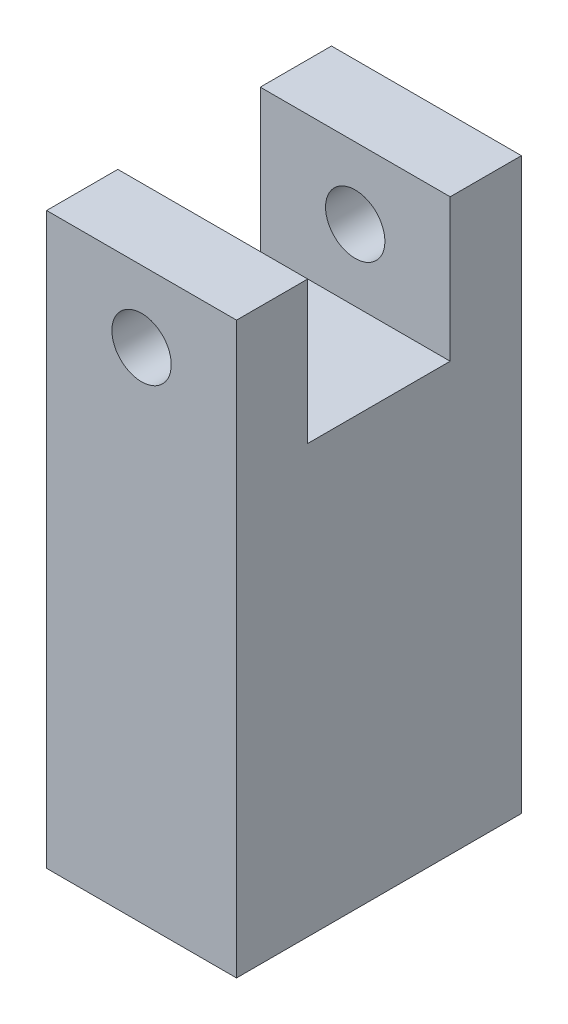
from build123d import *

# Parameters (mm, degrees)
SKETCH1_W           = 25.4
SKETCH1_H           = 76.2
BOSS_EXTRUDE1_DEPTH = 19.05
SKETCH2_W           = 19.05
SKETCH2_H           = 19.05
CUT_EXTRUDE1_DEPTH  = 50.595085442
CUT_EXTRUDE2_REACH  = 57.358
SKETCH4_R           = 3.96875


with BuildPart() as part:
    # Sketch1 → Boss-Extrude1 (new, symmetric)
    with BuildSketch(Plane.XY):
        Rectangle(SKETCH1_W, SKETCH1_H)
    extrude(amount=BOSS_EXTRUDE1_DEPTH, both=True)

    # Sketch2 → Cut-Extrude1 (cut, through all)
    with BuildSketch(Plane(origin=(12.7, 0, 0), x_dir=(0, 0, -1), z_dir=(1, 0, 0))):
        with Locations((0, 28.575)):
            Rectangle(SKETCH2_W, SKETCH2_H)
    extrude(amount=-CUT_EXTRUDE1_DEPTH, mode=Mode.SUBTRACT)

    # Cut-Extrude2: up to this face of the body (flat: up to its plane)
    cut_extrude2_end = Plane(part.part.faces().sort_by_distance((0, 0, -19.05))[0])
    # Sketch4 → Cut-Extrude2 (cut, up to the picked face)
    with BuildSketch(Plane.XY.offset(19.05), mode=Mode.PRIVATE) as cut_extrude2_sk1:
        with Locations((0, 28.575)):
            Circle(SKETCH4_R)
    cut_extrude2_tool1 = split(extrude(cut_extrude2_sk1.sketch, amount=-CUT_EXTRUDE2_REACH, mode=Mode.PRIVATE), bisect_by=cut_extrude2_end, keep=Keep.BOTH, mode=Mode.PRIVATE)
    add(cut_extrude2_tool1.solids().sort_by(Axis((0, 28.575, 19.05), (0, 0, -1)))[0], mode=Mode.SUBTRACT)


solid = part.part
